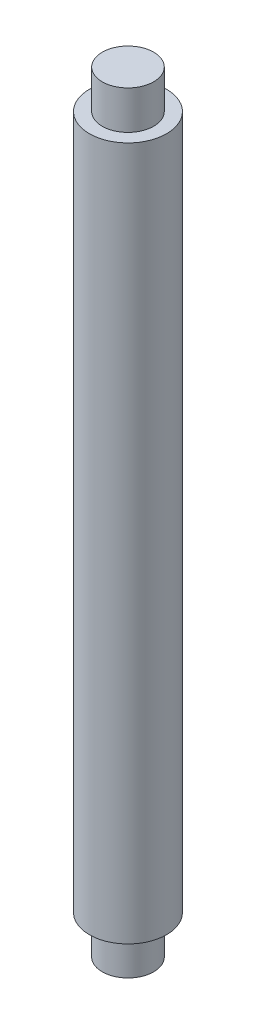
from build123d import *


with BuildPart() as part:
    # ｽｹｯﾁ1 → 回転1 (revolve)
    with BuildSketch(Plane(origin=(0, 0, 0), x_dir=(0, 0, -1), z_dir=(1, 0, 0)), mode=Mode.PRIVATE) as revolve_1_sk:
        Polygon((16.62899878, 37.806178794), (16.62899878, -22.193821206), (18.62899878, -22.193821206), (18.62899878, -19.193821206), (19.62899878, -19.193821206), (19.62899878, 34.806178794), (18.62899878, 34.806178794), (18.62899878, 37.806178794), align=None)
    revolve(revolve_1_sk.sketch.rotate(Axis((0, 37.806178794, -16.62899878), (0, -1, 0)), 180), axis=Axis((0, 37.806178794, -16.62899878), (0, -1, 0)))


solid = part.part
